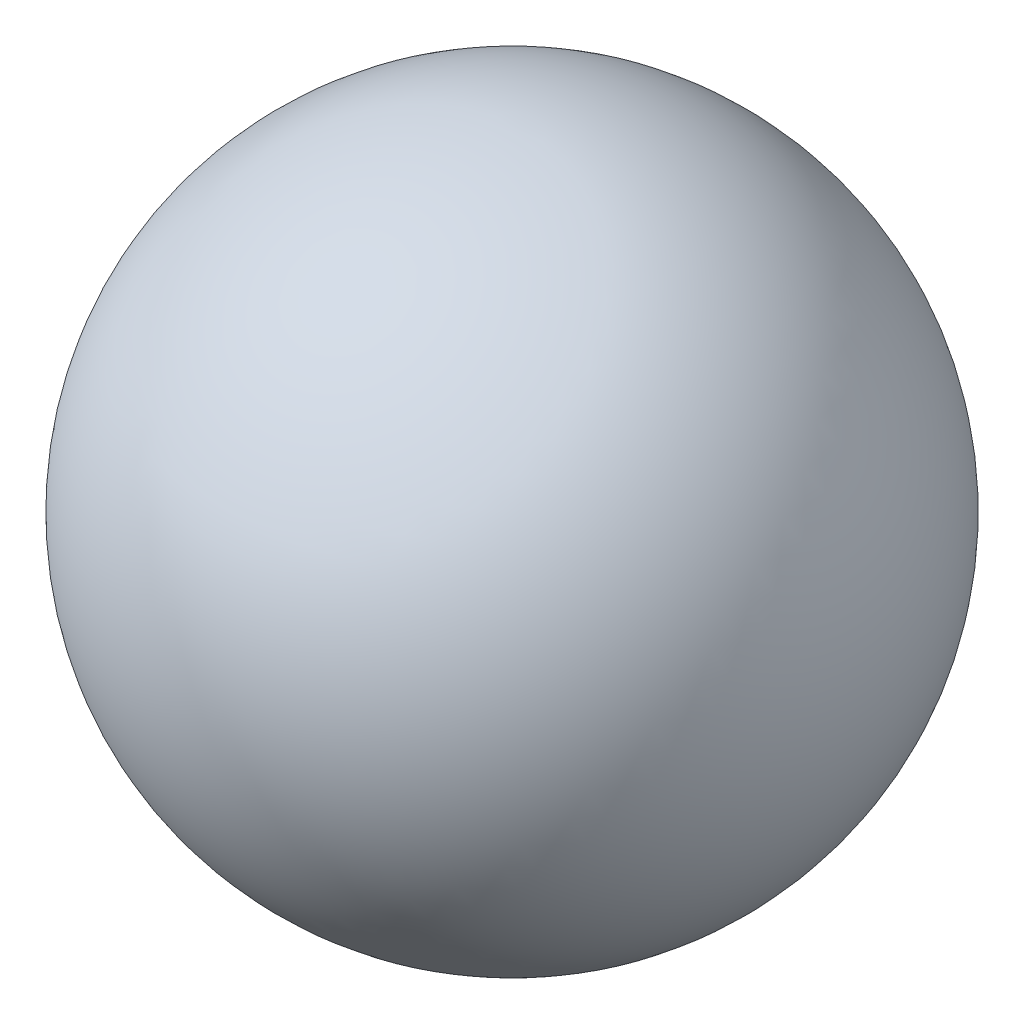
from build123d import *


with BuildPart() as part:
    # Sketch2 → Revolve1 (revolve)
    with BuildSketch(Plane.XY):
        with BuildLine():
            Line((0, 15.5), (0, 8.5))
            ThreePointArc((0, 8.5), (3.5, 12), (0, 15.5))
        make_face()
    revolve(axis=Axis((0, 15.5, 0), (0, -1, 0)))


solid = part.part
